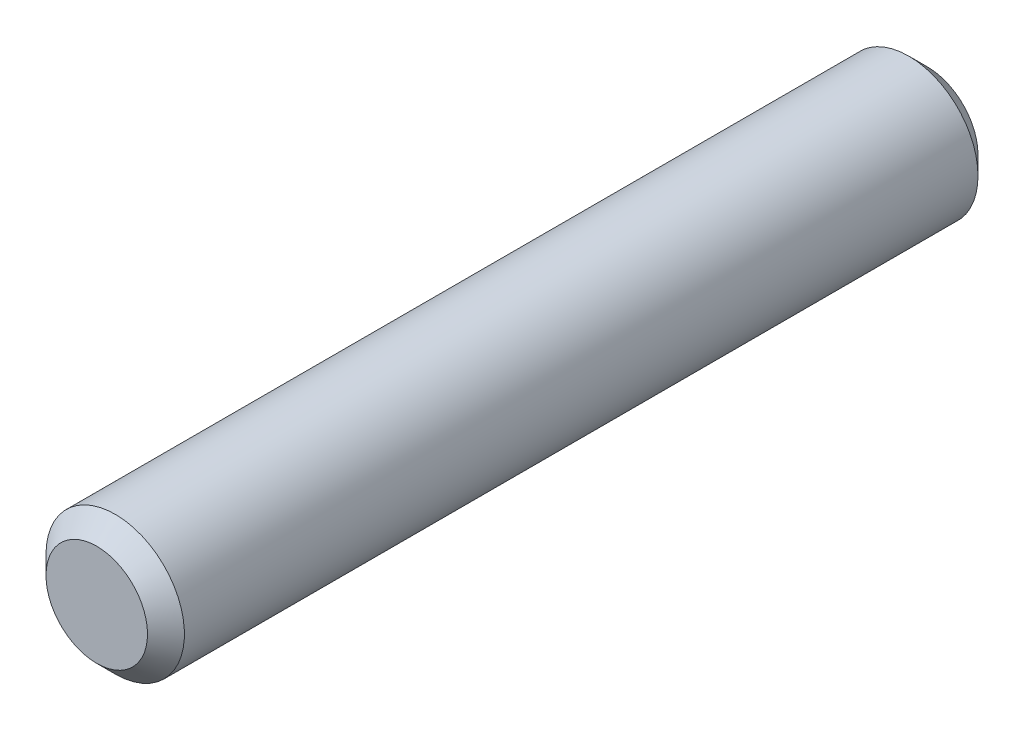
from build123d import *

# Parameters (mm, degrees)
SKETCH1_R           = 7.5
BOSS_EXTRUDE1_DEPTH = 90
CHAMFER1_SIZE       = 2


with BuildPart() as part:
    # Sketch1 → Boss-Extrude1 (new body)
    with BuildSketch(Plane.XY):
        with Locations(Location((0, 0, 0), (0, 0, 180))):
            Circle(SKETCH1_R)
    extrude(amount=BOSS_EXTRUDE1_DEPTH)

    # Chamfer1
    chamfer1_edges = [part.edges().sort_by_distance(p)[0] for p in [
        (7.5, 0, 0),
        (7.5, 0, 90),
    ]]
    chamfer(chamfer1_edges, length=CHAMFER1_SIZE)


solid = part.part
